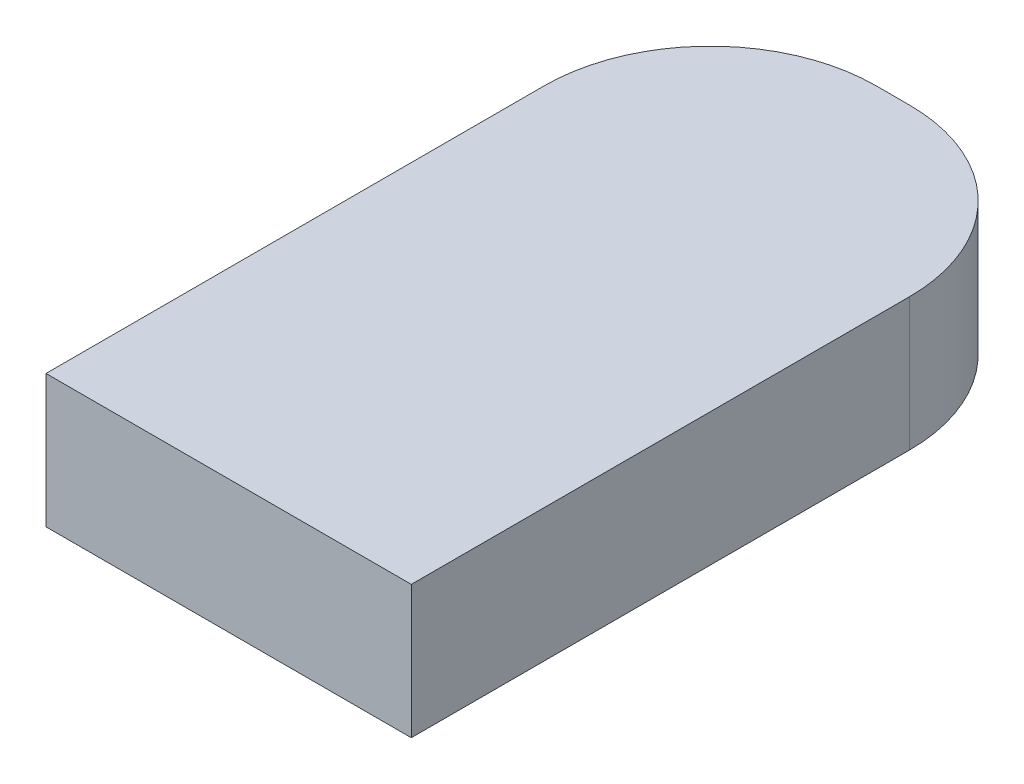
from build123d import *

# Parameters (mm, degrees)
BOSS_EXTRUDE1_DEPTH = 8


with BuildPart() as part:
    # Sketch1 → Boss-Extrude1 (new body)
    with BuildSketch(Plane(origin=(0, 0, 0), x_dir=(1, 0, 0), z_dir=(0, 1, 0))):
        with BuildLine():
            Line((0, 0), (22, 0))
            Line((22, 0), (22, 30))
            ThreePointArc((22, 30), (19.071067812, 37.071067812), (12, 40))
            Line((12, 40), (10, 40))
            ThreePointArc((10, 40), (2.928932188, 37.071067812), (0, 30))
            Line((0, 30), (0, 0))
        make_face()
    extrude(amount=BOSS_EXTRUDE1_DEPTH)


solid = part.part
